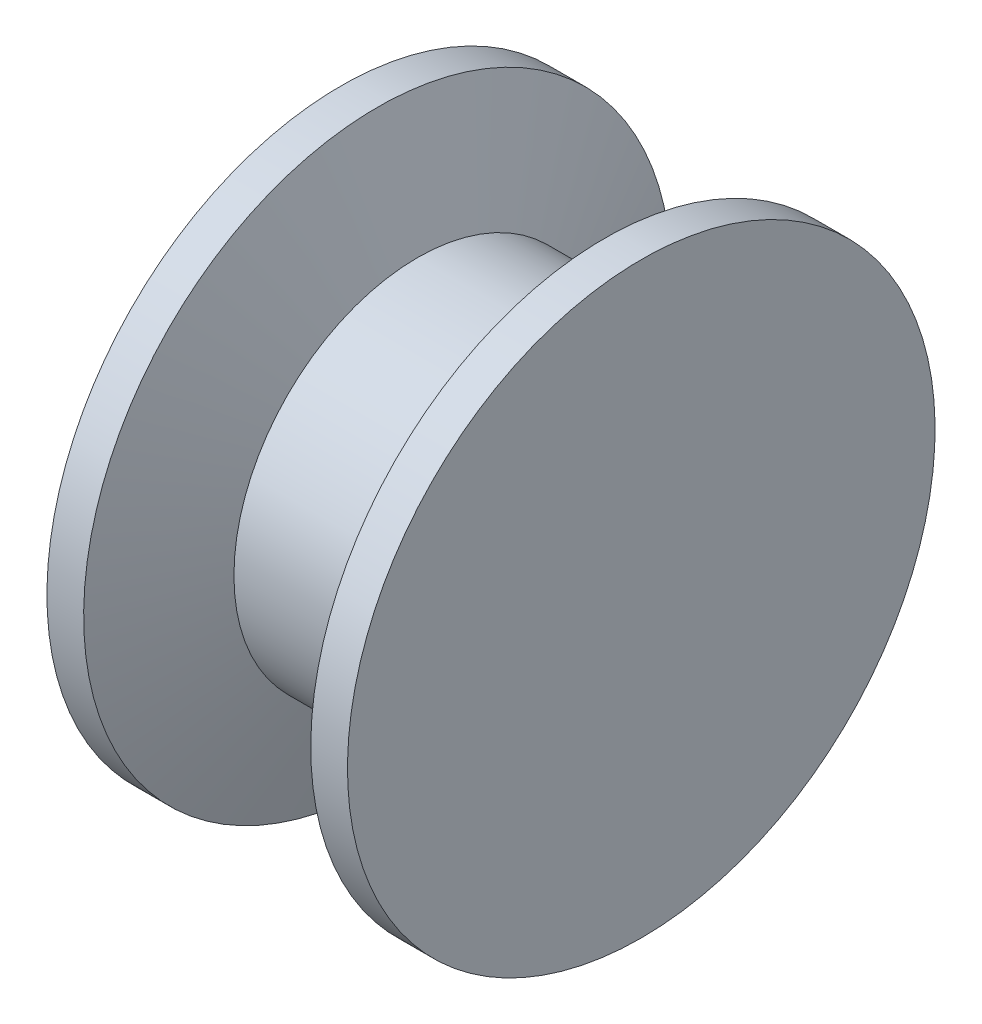
from build123d import *


with BuildPart() as part:
    # Sketch1 → Revolve1 (revolve)
    with BuildSketch(Plane.XY, mode=Mode.PRIVATE) as revolve1_sk:
        Polygon((-20.459553514, 29.790322713), (-15.459553514, 29.790322713), (-10, 14.790322713), (10, 14.790322713), (15.459553514, 29.790322713), (20.459553514, 29.790322713), (20.459553514, -10.209677287), (-20.459553514, -10.209677287), align=None)
    revolve(revolve1_sk.sketch.rotate(Axis((-20.459553514, -10.209677287, 0), (1, 0, 0)), 180), axis=Axis((-20.459553514, -10.209677287, 0), (1, 0, 0)))


solid = part.part
